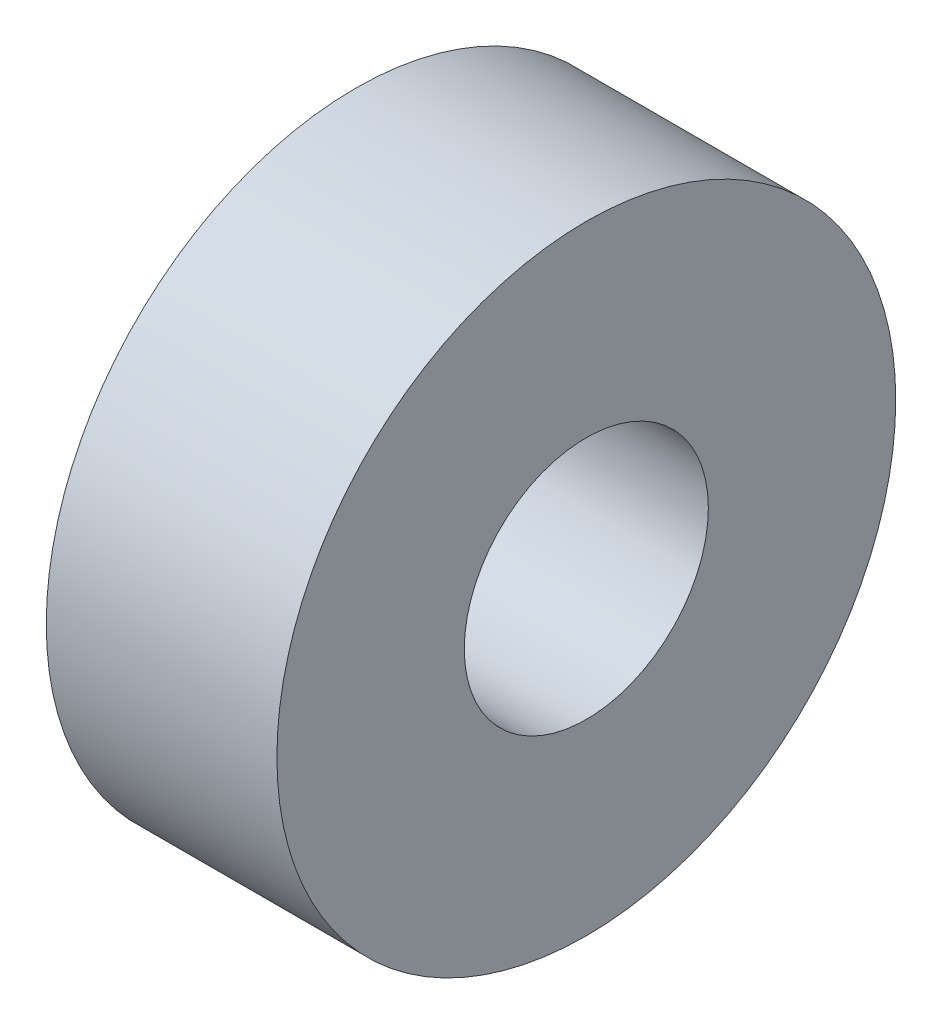
from build123d import *


with BuildPart() as part:
    # Croquis1 → Revolución1 (revolve)
    with BuildSketch(Plane.XY, mode=Mode.PRIVATE) as revoluci_n1_sk:
        Polygon((-6, 8.05), (0, 8.05), (0, 3.175), (-5, 3.175), (-5, 4.535), (-1.55, 4.535), (-1.55, 6.85), (-6, 6.85), align=None)
    revolve(revoluci_n1_sk.sketch.rotate(Axis((-5.712172619, 0, 0), (1, 0, 0)), 90), axis=Axis((-5.712172619, 0, 0), (1, 0, 0)))


solid = part.part
